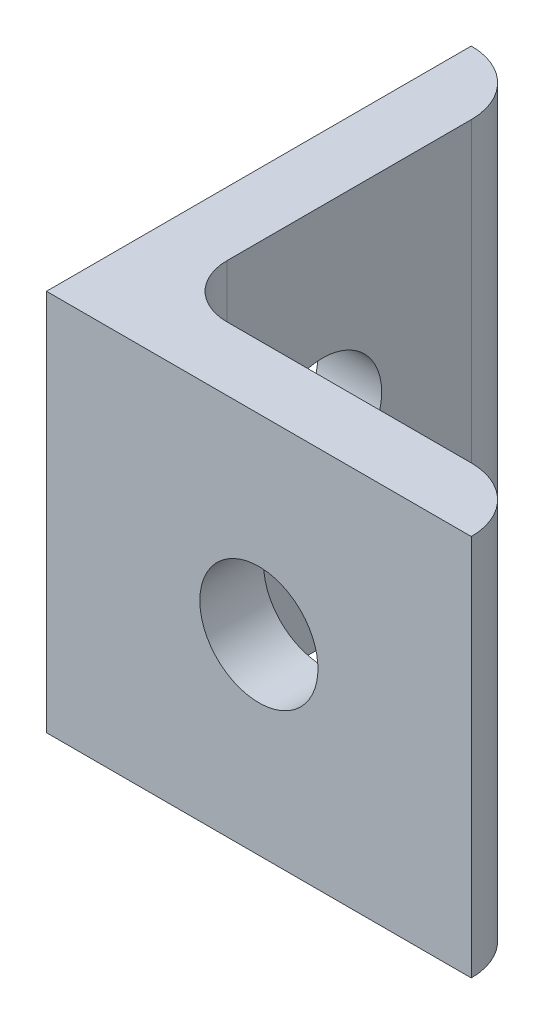
from build123d import *

# Parameters (mm, degrees)
BOSS_EXTRUDE1_DEPTH = 9
SKETCH2_R           = 2.78
CUT_EXTRUDE1_DEPTH  = 28.748873851
SKETCH3_R           = 2.78
CUT_EXTRUDE2_DEPTH  = 28.748873851


with BuildPart() as part:
    # Sketch1 → Boss-Extrude1 (new, symmetric)
    with BuildSketch(Plane(origin=(0, 0, 0), x_dir=(1, 0, 0), z_dir=(0, 1, 0))):
        with BuildLine():
            Line((0, 0), (0, 20))
            ThreePointArc((0, 20), (2.121320344, 19.121320344), (3, 17))
            Line((3, 17), (3, 5.5))
            ThreePointArc((3, 5.5), (3.732233047, 3.732233047), (5.5, 3))
            Line((5.5, 3), (17, 3))
            ThreePointArc((17, 3), (19.121320344, 2.121320344), (20, 0))
            Line((20, 0), (0, 0))
        make_face()
    extrude(amount=BOSS_EXTRUDE1_DEPTH, both=True)

    # Sketch2 → Cut-Extrude1 (cut, through all)
    with BuildSketch(Plane(origin=(0, 0, -3), x_dir=(-1, 0, 0), z_dir=(0, 0, -1))):
        with Locations((-10, 0)):
            Circle(SKETCH2_R)
    extrude(amount=-CUT_EXTRUDE1_DEPTH, mode=Mode.SUBTRACT)

    # Sketch3 → Cut-Extrude2 (cut, through all)
    with BuildSketch(Plane(origin=(3, 0, 0), x_dir=(0, 0, -1), z_dir=(1, 0, 0))):
        with Locations((10, 0)):
            Circle(SKETCH3_R)
    extrude(amount=-CUT_EXTRUDE2_DEPTH, mode=Mode.SUBTRACT)


solid = part.part
